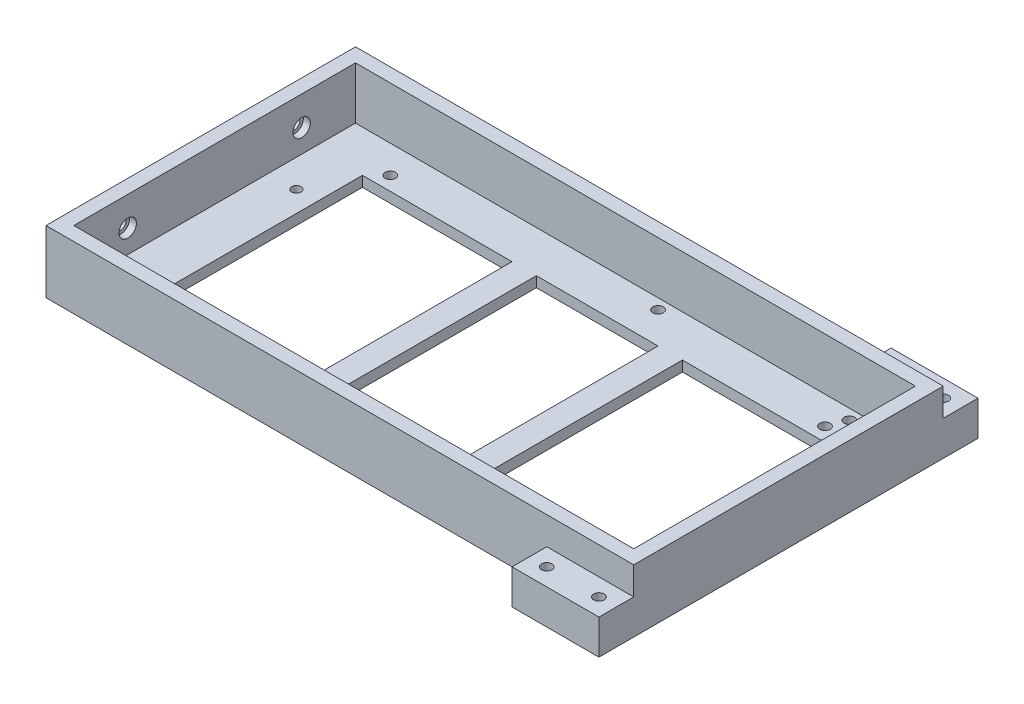
from build123d import *

# Parameters (mm, degrees)
SKETCH1_W               = 169
SKETCH1_H               = 89
SKETCH1_W_2             = 161
SKETCH1_H_2             = 81
BOSS_EXTRUDE1_DEPTH     = 15
SKETCH2_W               = 169
SKETCH2_H               = 89
SKETCH2_W_2             = 43
SKETCH2_H_2             = 57
SKETCH2_W_3             = 41
SKETCH2_W_4             = 35
BOSS_EXTRUDE2_DEPTH     = 3
SKETCH4_R               = 1.5
CUT_EXTRUDE1_DEPTH      = 13
SKETCH5_R               = 2.5
CUT_EXTRUDE2_DEPTH      = 2
SKETCH6_R               = 1.5
CUT_EXTRUDE3_DEPTH      = 10
SKETCH8_R               = 1.5
CUT_EXTRUDE4_DEPTH      = 4
MIRROR2_COPY_1_SKETCH_R = 1.5
MIRROR2_COPY_1_DEPTH    = 4
SKETCH10_R              = 1.35
CUT_EXTRUDE5_DEPTH      = 4
SKETCH11_W              = 25
SKETCH11_H              = 10
BOSS_EXTRUDE3_DEPTH     = 10
SKETCH12_R              = 1.5
CUT_EXTRUDE6_DEPTH      = 10


with BuildPart() as part:
    # Sketch1 → Boss-Extrude1 (new body)
    with BuildSketch(Plane(origin=(0, 0, 0), x_dir=(1, 0, 0), z_dir=(0, 1, 0))):
        Rectangle(SKETCH1_W, SKETCH1_H)
        Rectangle(SKETCH1_W_2, SKETCH1_H_2, mode=Mode.SUBTRACT)
    extrude(amount=BOSS_EXTRUDE1_DEPTH)

    # Sketch2 → Boss-Extrude2 (add)
    with BuildSketch(Plane(origin=(0, 0, 0), x_dir=(-1, 0, 0), z_dir=(0, -1, 0))):
        Rectangle(SKETCH2_W, SKETCH2_H)
        with Locations((45, 0)):
            Rectangle(SKETCH2_W_2, SKETCH2_H_2, mode=Mode.SUBTRACT)
        with Locations((-46, 0)):
            Rectangle(SKETCH2_W_3, SKETCH2_H_2, mode=Mode.SUBTRACT)
        with Locations((-1, 0)):
            Rectangle(SKETCH2_W_4, SKETCH2_H_2, mode=Mode.SUBTRACT)
    extrude(amount=BOSS_EXTRUDE2_DEPTH)

    # Sketch4 → Cut-Extrude1 (cut)
    with BuildSketch(Plane(origin=(-80.5, 0, 0), x_dir=(0, 0, -1), z_dir=(1, 0, 0))):
        with Locations((-25, 6.604468408)):
            Circle(SKETCH4_R)
        with Locations((25, 6.604468408)):
            Circle(SKETCH4_R)
    extrude(amount=-CUT_EXTRUDE1_DEPTH, mode=Mode.SUBTRACT)

    # Sketch5 → Cut-Extrude2 (cut)
    with BuildSketch(Plane(origin=(-80.5, 0, 0), x_dir=(0, 0, -1), z_dir=(1, 0, 0))):
        with Locations((-25, 6.604468408)):
            Circle(SKETCH5_R)
        with Locations((25, 6.604468408)):
            Circle(SKETCH5_R)
    extrude(amount=-CUT_EXTRUDE2_DEPTH, mode=Mode.SUBTRACT)

    # Sketch6 → Cut-Extrude3 (cut)
    with BuildSketch(Plane(origin=(0, -3, 0), x_dir=(-1, 0, 0), z_dir=(0, -1, 0))):
        with Locations(Location((-9.5, 37.5, 0), (0, 0, 90))):
            Circle(SKETCH6_R)
        with Locations(Location((-64.5, 37.5, 0), (0, 0, 90))):
            Circle(SKETCH6_R)
    extrude(amount=-CUT_EXTRUDE3_DEPTH, mode=Mode.SUBTRACT)

    # Sketch8 → Cut-Extrude4 (cut)
    with BuildSketch(Plane(origin=(0, 0, 0), x_dir=(1, 0, 0), z_dir=(0, 1, 0))):
        with Locations(Location((-62.5, 32.5, 0), (0, 0, 270))):
            Circle(SKETCH8_R)
    cut_extrude4 = extrude(amount=-CUT_EXTRUDE4_DEPTH, mode=Mode.SUBTRACT)

    # Mirror1: Cut-Extrude4 across plane
    add(cut_extrude4.mirror(Plane(origin=(0, 0, 0), x_dir=(0, 0, 1), z_dir=(1, 0, 0))), mode=Mode.SUBTRACT)

    # Mirror2: Cut-Extrude4 across plane
    add(cut_extrude4.mirror(Plane.XY), mode=Mode.SUBTRACT)

    # Mirror2 copy 1 sketch → Mirror2 copy 1 (cut)
    with BuildSketch(Plane(origin=(0, 0, 0), x_dir=(-1, 0, 0), z_dir=(0, 1, 0))):
        with Locations(Location((-62.5, 32.5, 0), (0, 0, 270))):
            Circle(MIRROR2_COPY_1_SKETCH_R)
    extrude(amount=-MIRROR2_COPY_1_DEPTH, mode=Mode.SUBTRACT)

    # Sketch10 → Cut-Extrude5 (cut)
    with BuildSketch(Plane.XZ.offset(3)):
        with Locations(Location((72.5, 15.5, 0), (0, 0, 270))):
            Circle(SKETCH10_R)
        with Locations(Location((-72.5, -15.5, 0), (0, 0, 270))):
            Circle(SKETCH10_R)
    extrude(amount=-CUT_EXTRUDE5_DEPTH, mode=Mode.SUBTRACT)

    # Sketch11 → Boss-Extrude3 (add)
    with BuildSketch(Plane.XZ.offset(3)):
        with Locations((72, 49.5)):
            Rectangle(SKETCH11_W, SKETCH11_H)
    boss_extrude3 = extrude(amount=-BOSS_EXTRUDE3_DEPTH)

    # Sketch12 → Cut-Extrude6 (cut)
    with BuildSketch(Plane.XZ.offset(3)):
        with Locations(Location((64.5, 49.5, 0), (0, 0, 270))):
            Circle(SKETCH12_R)
        with Locations(Location((79.5, 49.5, 0), (0, 0, 270))):
            Circle(SKETCH12_R)
    cut_extrude6 = extrude(amount=-CUT_EXTRUDE6_DEPTH, mode=Mode.SUBTRACT)

    # Mirror3: Boss-Extrude3, Cut-Extrude6 across plane
    add(boss_extrude3.mirror(Plane.XY))
    add(cut_extrude6.mirror(Plane.XY), mode=Mode.SUBTRACT)


solid = part.part
